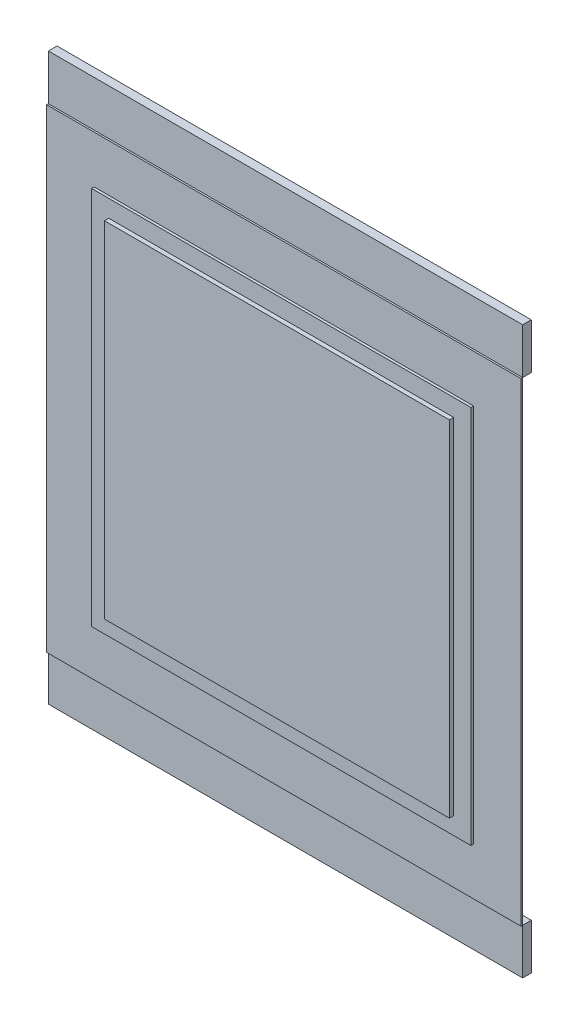
from build123d import *

# Parameters (mm, degrees)
SKETCH1_W             = 400
SKETCH1_H             = 400
BOSS_EXTRUDE1_DEPTH   = 10
SKETCH2_W             = 440
SKETCH2_H             = 440
BOSS_EXTRUDE2_DEPTH   = 5
SKETCH3_W             = 550
SKETCH3_H             = 550
BOSS_EXTRUDE3_DEPTH   = 2
SKETCH4_W             = 550
SKETCH4_H             = 53
BOSS_EXTRUDE4_DEPTH   = 10
BOSS_EXTRUDE4_2_DEPTH = 10


with BuildPart() as part:
    # Sketch1 → Boss-Extrude1 (new body)
    with BuildSketch(Plane(origin=(0, 0, 0), x_dir=(0, 1, 0), z_dir=(0, 0, 1))):
        Rectangle(SKETCH1_W, SKETCH1_H)
    extrude(amount=BOSS_EXTRUDE1_DEPTH)

    # Sketch2 → Boss-Extrude2 (add)
    with BuildSketch(Plane(origin=(0, 0, 0), x_dir=(1, 0, 0), z_dir=(0, 0, -1))):
        Rectangle(SKETCH2_W, SKETCH2_H)
    extrude(amount=-BOSS_EXTRUDE2_DEPTH)

    # Sketch3 → Boss-Extrude3 (add)
    with BuildSketch(Plane(origin=(0, 0, 0), x_dir=(1, 0, 0), z_dir=(0, 0, -1))):
        Rectangle(SKETCH3_W, SKETCH3_H)
    extrude(amount=-BOSS_EXTRUDE3_DEPTH)


with BuildPart() as body_2:
    # Sketch4 → Boss-Extrude4 (new body)
    with BuildSketch(Plane(origin=(0, 0, 0), x_dir=(1, 0, 0), z_dir=(0, 0, -1))):
        with Locations((0, 301.5)):
            Rectangle(SKETCH4_W, SKETCH4_H)
    extrude(amount=BOSS_EXTRUDE4_DEPTH)


with BuildPart() as body_3:
    # Sketch4 → Boss-Extrude4 2 (new body)
    with BuildSketch(Plane(origin=(0, 0, 0), x_dir=(1, 0, 0), z_dir=(0, 0, -1))):
        with Locations((0, -301.5)):
            Rectangle(SKETCH4_W, SKETCH4_H)
    extrude(amount=BOSS_EXTRUDE4_2_DEPTH)


solid = Compound([part.part, body_2.part, body_3.part])
